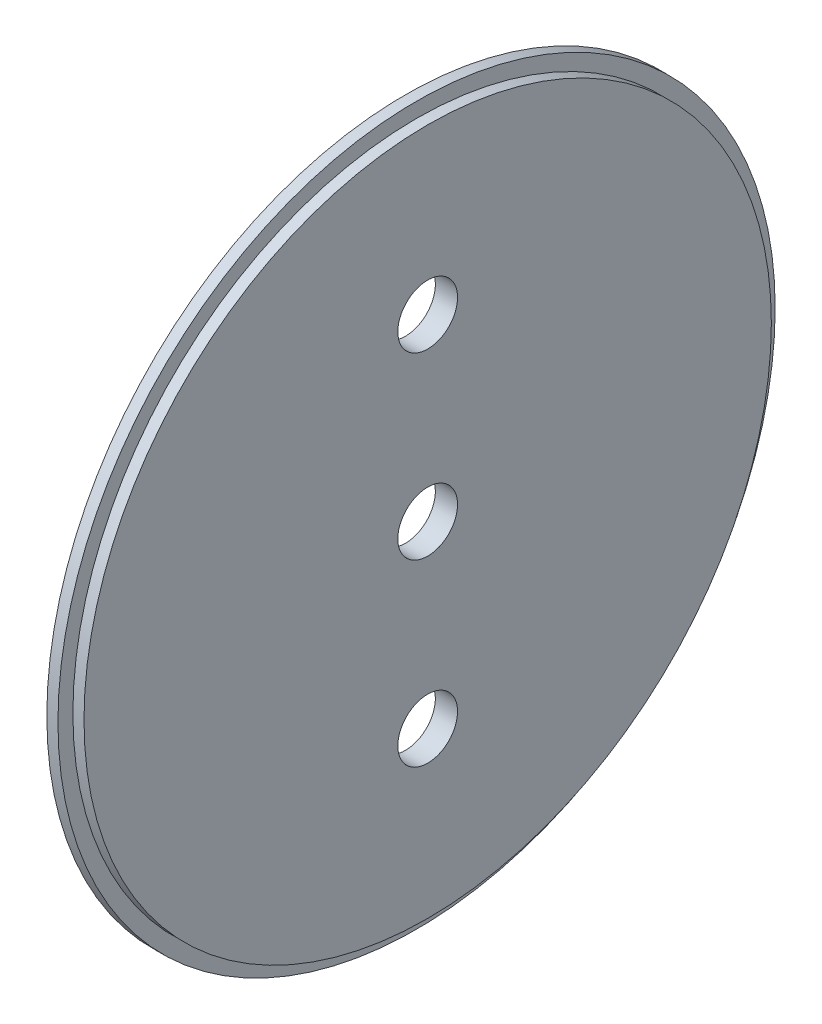
from build123d import *

# Parameters (mm, degrees)
SKETCH1_R           = 38.1
BOSS_EXTRUDE1_DEPTH = 1.1811
SKETCH2_R           = 36.5125
BOSS_EXTRUDE2_DEPTH = 1.1811
SKETCH3_R           = 3.175
CUT_EXTRUDE1_DEPTH  = 54.933292027


with BuildPart() as part:
    # Sketch1 → Boss-Extrude1 (new body)
    with BuildSketch(Plane.YZ):
        with Locations(Location((0, 0, 0), (0, 0, 270))):
            Circle(SKETCH1_R)
    extrude(amount=BOSS_EXTRUDE1_DEPTH)

    # Sketch2 → Boss-Extrude2 (add)
    with BuildSketch(Plane.YZ.offset(1.1811)):
        with Locations(Location((0, 0, 0), (0, 0, 270))):
            Circle(SKETCH2_R)
    extrude(amount=BOSS_EXTRUDE2_DEPTH)

    # Sketch3 → Cut-Extrude1 (cut, through all)
    with BuildSketch(Plane(origin=(0, 0, 0), x_dir=(0, -1, 0), z_dir=(-1, 0, 0))):
        with Locations(Location((0, 0, 0), (0, 0, 90))):
            Circle(SKETCH3_R)
        with Locations(Location((19.05, 0, 0), (0, 0, 90))):
            Circle(SKETCH3_R)
        with Locations(Location((-19.05, 0, 0), (0, 0, 90))):
            Circle(SKETCH3_R)
    extrude(amount=-CUT_EXTRUDE1_DEPTH, mode=Mode.SUBTRACT)


solid = part.part
